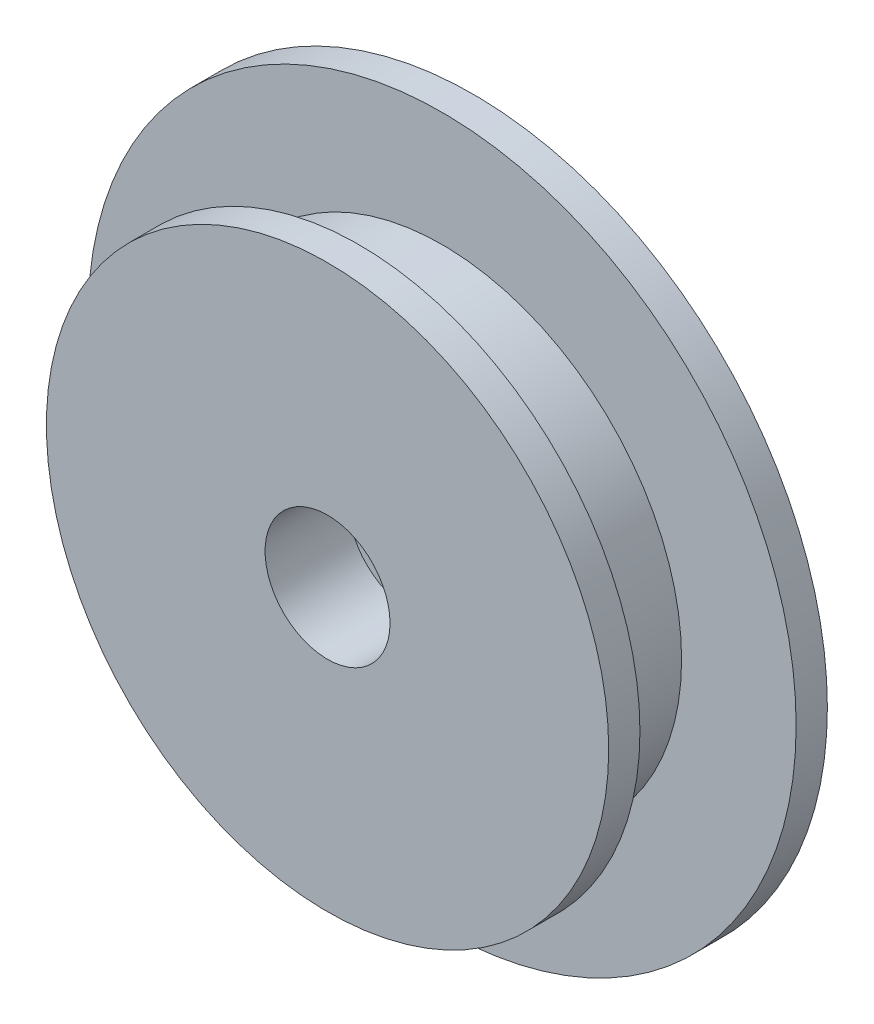
from build123d import *

# Parameters (mm, degrees)
SKETCH_2_R          = 17
EXTRUDE_1_DEPTH     = 1.5
SKETCH_3_R          = 11.5
EXTRUDE_2_DEPTH     = 4
SKETCH_4_R          = 13.5
EXTRUDE_3_DEPTH     = 1.5
SKETCH_5_R          = 1.75
CUT_EXTRUDE_1_DEPTH = 26.039968051
SKETCH_6_R          = 3
CUT_EXTRUDE_2_DEPTH = 4


with BuildPart() as part:
    # 草图2 → 凸台-拉伸1 (new body)
    with BuildSketch(Plane.XY):
        Circle(SKETCH_2_R)
    extrude(amount=EXTRUDE_1_DEPTH)

    # 草图3 → 凸台-拉伸2 (add)
    with BuildSketch(Plane.XY.offset(1.5)):
        Circle(SKETCH_3_R)
    extrude(amount=EXTRUDE_2_DEPTH)

    # 草图4 → 凸台-拉伸3 (add)
    with BuildSketch(Plane.XY.offset(5.5)):
        Circle(SKETCH_4_R)
    extrude(amount=EXTRUDE_3_DEPTH)

    # 草图5 → 切除-拉伸1 (cut, through all)
    with BuildSketch(Plane.XY.offset(7)):
        Circle(SKETCH_5_R)
    extrude(amount=-CUT_EXTRUDE_1_DEPTH, mode=Mode.SUBTRACT)

    # 草图6 → 切除-拉伸2 (cut)
    with BuildSketch(Plane.XY.offset(7)):
        Circle(SKETCH_6_R)
    extrude(amount=-CUT_EXTRUDE_2_DEPTH, mode=Mode.SUBTRACT)


solid = part.part
